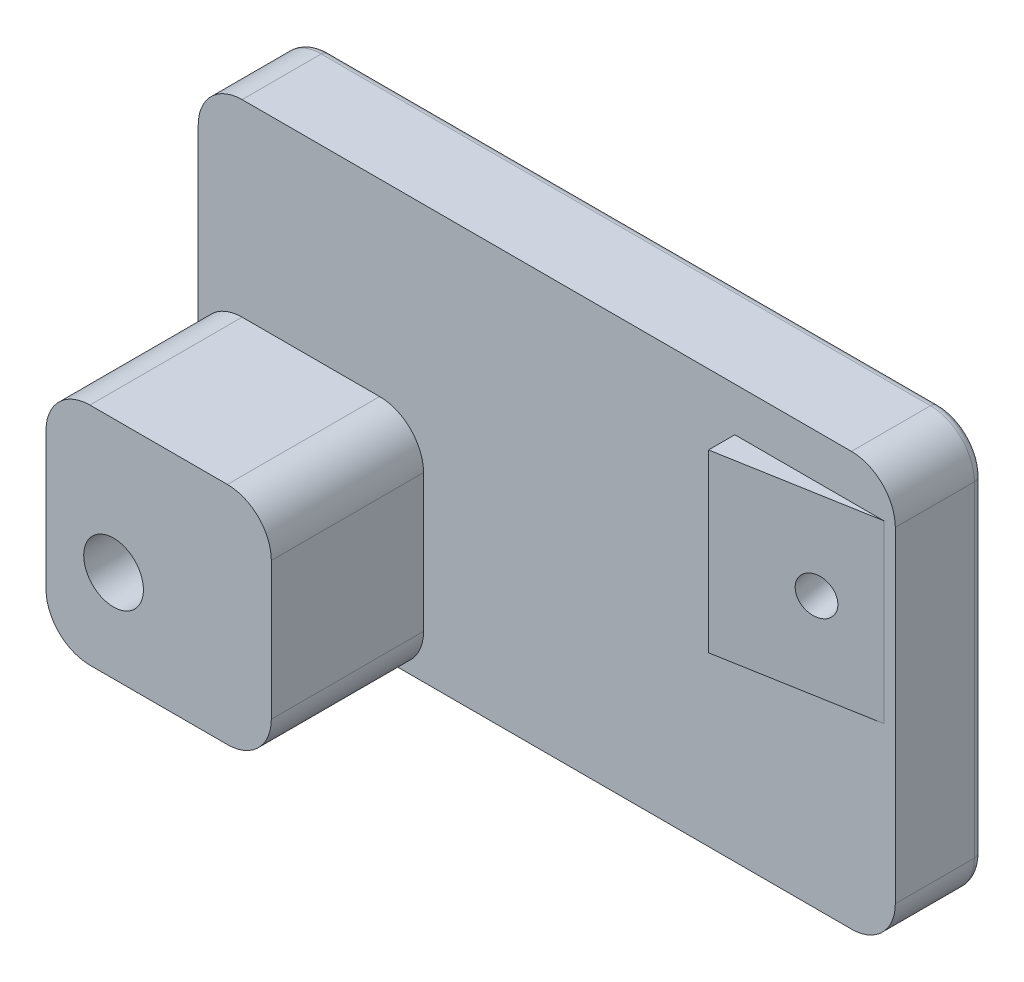
from build123d import *

# Parameters (mm, degrees)
SKETCH1_W           = 43.699940619
SKETCH1_H           = 33.102984907
BOSS_EXTRUDE1_DEPTH = 10
BOSS_EXTRUDE3_DEPTH = 10
M5_TAPPED_HOLE1_D   = 4.2
SKETCH18_W          = 13
SKETCH18_H          = 47.102984907
CUT_EXTRUDE1_DEPTH  = 10
SKETCH20_W          = 10
SKETCH20_H          = 17.102984907
CUT_EXTRUDE3_DEPTH  = 10
SKETCH22_W          = 20.699940619
SKETCH22_H          = 17.102984907
BOSS_EXTRUDE4_DEPTH = 17.3288
SKETCH23_W          = 58.662437665
SKETCH23_H          = 17.102984907
BOSS_EXTRUDE5_DEPTH = 10
BOSS_EXTRUDE6_DEPTH = 20
M8_TAPPED_HOLE3_D   = 6.8
FILLET4_R           = 5
FILLET6_R           = 5
FILLET7_R           = 1


with BuildPart() as part:
    # Sketch1 → Boss-Extrude1 (new body)
    with BuildSketch(Plane.XY):
        Polygon((42.979890311, 22.079670103), (-49.382487973, 22.079670103), (-49.382487973, -7.920329897), (-5.682547354, -7.920329897), (42.979890311, -7.920329897), align=None)
        with Locations((-27.532517664, -24.471822351)):
            Rectangle(SKETCH1_W, SKETCH1_H)
    extrude(amount=BOSS_EXTRUDE1_DEPTH)

    # Sketch10 → Boss-Extrude3 (add, symmetric)
    with BuildSketch(Plane(origin=(0, 7.079670103, 0), x_dir=(-1, 0, 0), z_dir=(0, -1, 0))):
        Polygon((-24.707127971, -10), (-24.707127971, -12.991563555), (-41.673127971, -10), align=None)
    extrude(amount=BOSS_EXTRUDE3_DEPTH, both=True)

    # M5 Tapped Hole1 (through all)
    with Locations(Plane(origin=(35.156022436, 6.992687386, 11.149141542), x_dir=(0.984807753012, 0, -0.173648177667), z_dir=(0.173648177667, 0, 0.984807753012))):
        with Locations((0, 0)):
            Hole(M5_TAPPED_HOLE1_D / 2)

    # Sketch18 → Cut-Extrude1 (cut)
    with BuildSketch(Plane.XY.offset(10)):
        Polygon((-36.382487973, -25.023314804), (-49.382487973, -25.023314804), (-49.382487973, -41.023314804), (-5.682547354, -41.023314804), (-5.682547354, -25.023314804), align=None)
        with Locations((-42.882487973, -1.471822351)):
            Rectangle(SKETCH18_W, SKETCH18_H)
    extrude(amount=-CUT_EXTRUDE1_DEPTH, mode=Mode.SUBTRACT)

    # Sketch20 → Cut-Extrude3 (cut)
    with BuildSketch(Plane(origin=(0, 0, 0), x_dir=(-1, 0, 0), z_dir=(0, 0, -1))):
        with Locations((10.682547354, -16.471822351)):
            Rectangle(SKETCH20_W, SKETCH20_H)
    extrude(amount=-CUT_EXTRUDE3_DEPTH, mode=Mode.SUBTRACT)

    # Sketch22 → Boss-Extrude4 (add)
    with BuildSketch(Plane.XY.offset(10)):
        with Locations((-26.032517664, -16.471822351)):
            Rectangle(SKETCH22_W, SKETCH22_H)
    extrude(amount=BOSS_EXTRUDE4_DEPTH)

    # Sketch23 → Boss-Extrude5 (add)
    with BuildSketch(Plane(origin=(0, 0, 0), x_dir=(-1, 0, 0), z_dir=(0, 0, -1))):
        with Locations((-13.648671479, -16.471822351)):
            Rectangle(SKETCH23_W, SKETCH23_H)
    extrude(amount=-BOSS_EXTRUDE5_DEPTH)

    # Sketch27 → Boss-Extrude6 (add)
    with BuildSketch(Plane.XY.offset(27.3288)):
        with BuildLine():
            Line((-36.382487973, -25.023314804), (-15.730623406, -25.023314804))
            ThreePointArc((-15.730623406, -25.023314804), (-12.1950895, -23.55884871), (-10.730623406, -20.023314804))
            Line((-10.730623406, -20.023314804), (-10.730623406, -4.371450237))
            ThreePointArc((-10.730623406, -4.371450237), (-12.1950895, -0.835916331), (-15.730623406, 0.628549763))
            Line((-15.730623406, 0.628549763), (-31.382487973, 0.628549763))
            ThreePointArc((-31.382487973, 0.628549763), (-34.918021878, -0.835916331), (-36.382487973, -4.371450237))
            Line((-36.382487973, -4.371450237), (-36.382487973, -25.023314804))
        make_face()
    extrude(amount=-BOSS_EXTRUDE6_DEPTH)

    # M8 Tapped Hole3 (through all)
    with Locations(Plane(origin=(-28.692487973, -14.540329897, 0), x_dir=(-1, 0, 0), z_dir=(0, 0, -1))):
        with Locations((0, 0)):
            Hole(M8_TAPPED_HOLE3_D / 2)

    # Fillet4
    fillet4_edges = [part.edges().sort_by_distance(p)[0] for p in [
        (-36.382487973, -25.023314804, 13.6644),
    ]]
    fillet(fillet4_edges, radius=FILLET4_R)

    # Fillet6
    fillet6_edges = [part.edges().sort_by_distance(p)[0] for p in [
        (-36.382487973, 22.079670103, 5),
        (42.979890311, 22.079670103, 5),
        (42.979890311, -25.023314804, 5),
    ]]
    fillet(fillet6_edges, radius=FILLET6_R)

    # Fillet7
    fillet7_edges = [part.edges().sort_by_distance(p)[0] for p in [
        (3.298701169, -25.023314804, 0),
        (-34.918021878, -23.55884871, 0),
        (3.298701169, 22.079670103, 0),
        (-36.382487973, -1.471822351, 0),
        (42.979890311, -1.471822351, 0),
        (-34.918021878, 20.615204009, 0),
        (41.515424217, -23.55884871, 0),
        (41.515424217, 20.615204009, 0),
    ]]
    fillet(fillet7_edges, radius=FILLET7_R)


solid = part.part
